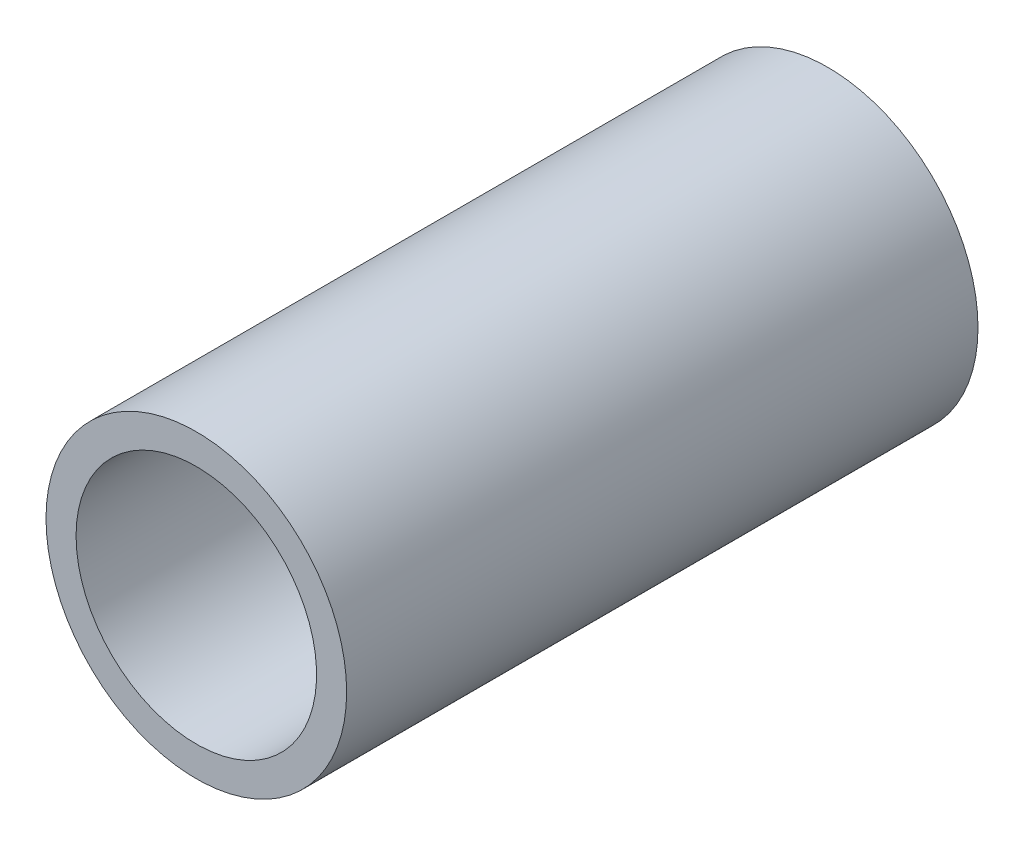
from build123d import *

# Parameters (mm, degrees)
SKETCH_1_R      = 5
SKETCH_1_R_2    = 4
EXTRUDE_1_DEPTH = 21


with BuildPart() as part:
    # 草图1 → 凸台-拉伸1 (new body)
    with BuildSketch(Plane.XY):
        with Locations(Location((0, 0, 0), (0, 0, 180))):
            Circle(SKETCH_1_R)
        with Locations(Location((0, 0, 0), (0, 0, 180))):
            Circle(SKETCH_1_R_2, mode=Mode.SUBTRACT)
    extrude(amount=EXTRUDE_1_DEPTH)


solid = part.part
